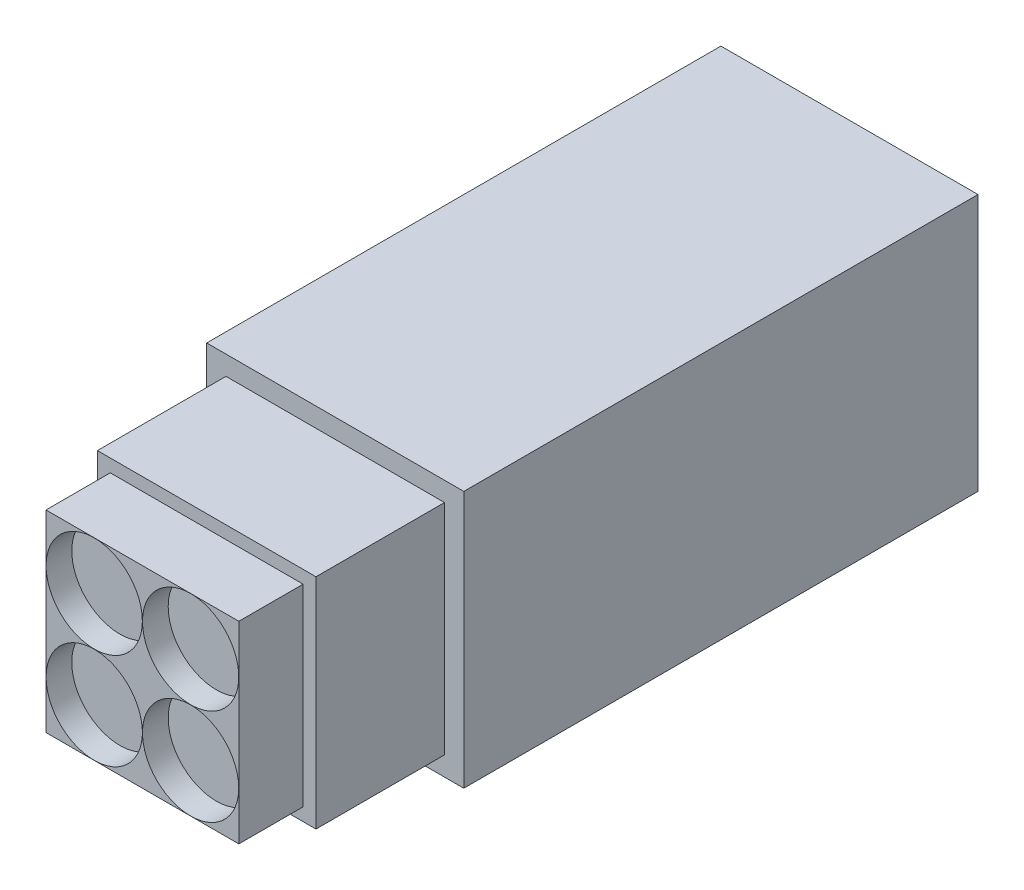
from build123d import *

# Parameters (mm, degrees)
SKETCH_1_W          = 20
SKETCH_1_H          = 20
EXTRUDE_1_DEPTH     = 40
SKETCH_2_W          = 17
SKETCH_2_H          = 17
EXTRUDE_2_DEPTH     = 10
SKETCH_3_W          = 15
SKETCH_3_H          = 15
EXTRUDE_3_DEPTH     = 5
SKETCH_4_R          = 3.745
CUT_EXTRUDE_1_DEPTH = 2


with BuildPart() as part:
    # ｽｹｯﾁ1 → ﾎﾞｽ - 押し出し1 (new body)
    with BuildSketch(Plane.XY):
        Rectangle(SKETCH_1_W, SKETCH_1_H)
    extrude(amount=EXTRUDE_1_DEPTH)

    # ｽｹｯﾁ2 → ﾎﾞｽ - 押し出し2 (add)
    with BuildSketch(Plane.XY.offset(40)):
        Rectangle(SKETCH_2_W, SKETCH_2_H)
    extrude(amount=EXTRUDE_2_DEPTH)

    # ｽｹｯﾁ3 → ﾎﾞｽ - 押し出し3 (add)
    with BuildSketch(Plane.XY.offset(50)):
        Rectangle(SKETCH_3_W, SKETCH_3_H)
    extrude(amount=EXTRUDE_3_DEPTH)

    # ｽｹｯﾁ4 → ｶｯﾄ - 押し出し1 (cut)
    with BuildSketch(Plane.XY.offset(55)):
        with Locations((-3.75, 3.75)):
            Circle(SKETCH_4_R)
        with Locations(Location((3.75, 3.75, 0), (0, 0, 180))):
            Circle(SKETCH_4_R)
        with Locations((3.75, -3.75)):
            Circle(SKETCH_4_R)
        with Locations(Location((-3.75, -3.75, 0), (0, 0, 180))):
            Circle(SKETCH_4_R)
    extrude(amount=-CUT_EXTRUDE_1_DEPTH, mode=Mode.SUBTRACT)


solid = part.part
